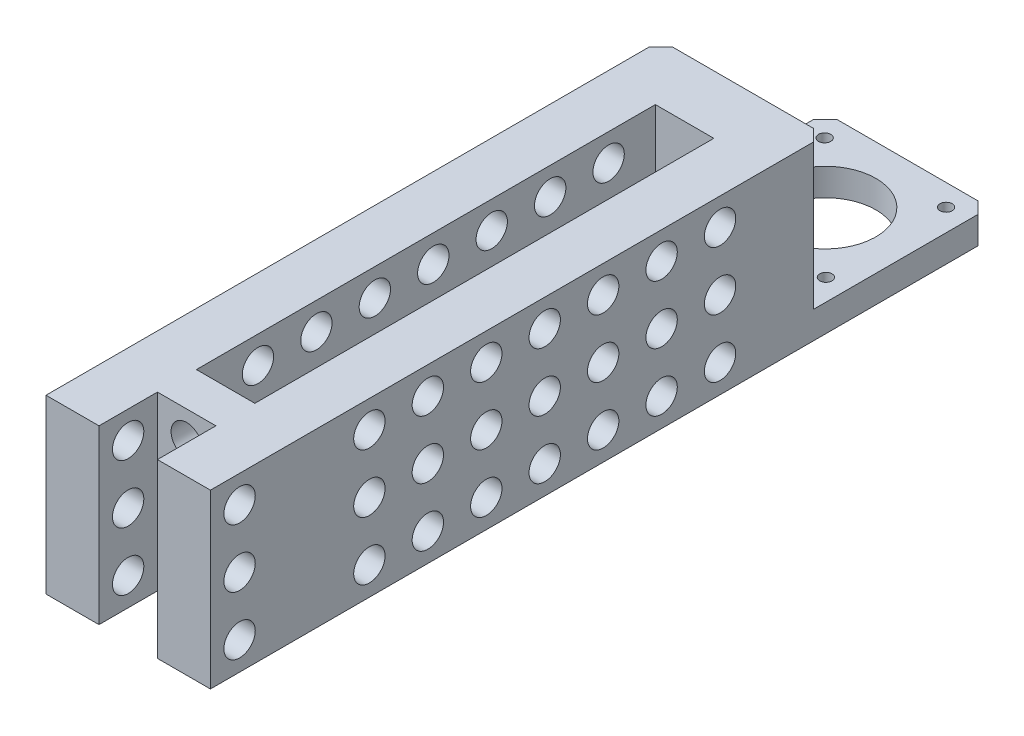
from build123d import *

# Parameters (mm, degrees)
SKETCH1_W           = 15
SKETCH1_H           = 117.8
BOSS_EXTRUDE1_DEPTH = 44.2
SKETCH2_W           = 42.2
SKETCH2_H           = 42.2
CUT_EXTRUDE1_DEPTH  = 37.2
SKETCH3_R           = 13
SKETCH3_R_2         = 1.575
SKETCH3_R_3         = 4.1
CUT_EXTRUDE2_DEPTH  = 30
SKETCH5_R           = 4.025
CUT_EXTRUDE3_DEPTH  = 55
SKETCH6_R           = 4
CUT_EXTRUDE4_DEPTH  = 10
CHAMFER1_SIZE       = 3


with BuildPart() as part:
    # Sketch1 → Boss-Extrude1 (new body)
    with BuildSketch(Plane(origin=(0, 0, 0), x_dir=(1, 0, 0), z_dir=(0, 1, 0))):
        Polygon((0, 0), (-42.2, 0), (-42.2, -200), (-28.6, -200), (-28.6, -185), (-13.6, -185), (-13.6, -200), (0, -200), align=None)
        with Locations((-21.1, -116.1)):
            Rectangle(SKETCH1_W, SKETCH1_H, mode=Mode.SUBTRACT)
    extrude(amount=BOSS_EXTRUDE1_DEPTH)

    # Sketch2 → Cut-Extrude1 (cut)
    with BuildSketch(Plane(origin=(0, 44.2, 0), x_dir=(1, 0, 0), z_dir=(0, 1, 0))):
        with Locations((-21.1, -21.1)):
            Rectangle(SKETCH2_W, SKETCH2_H)
    extrude(amount=-CUT_EXTRUDE1_DEPTH, mode=Mode.SUBTRACT)

    # Sketch3 → Cut-Extrude2 (cut)
    with BuildSketch(Plane.XZ):
        with Locations(Location((-21.1, 21.1, 0), (0, 0, 270))):
            Circle(SKETCH3_R)
        with Locations(Location((-36.519316662, 36.680683338, 0), (0, 0, 270))):
            Circle(SKETCH3_R_2)
        with Locations(Location((-5.519316662, 36.519316662, 0), (0, 0, 270))):
            Circle(SKETCH3_R_2)
        with Locations(Location((-5.680683338, 5.519316662, 0), (0, 0, 270))):
            Circle(SKETCH3_R_2)
        with Locations(Location((-36.680683338, 5.680683338, 0), (0, 0, 270))):
            Circle(SKETCH3_R_2)
        with Locations(Location((-21.1, 50, 0), (0, 0, 270))):
            Circle(SKETCH3_R_3)
        with Locations(Location((-5.6, 50, 0), (0, 0, 270))):
            Circle(SKETCH3_R_3)
        with Locations(Location((-36.6, 50, 0), (0, 0, 270))):
            Circle(SKETCH3_R_3)
    extrude(amount=-CUT_EXTRUDE2_DEPTH, mode=Mode.SUBTRACT)

    # Sketch5 → Cut-Extrude3 (cut)
    with BuildSketch(Plane(origin=(0, 0, 0), x_dir=(0, 0, -1), z_dir=(1, 0, 0))):
        with Locations((-69.2, 37.2)):
            Circle(SKETCH5_R)
        with Locations((-84.2, 37.2)):
            Circle(SKETCH5_R)
        with Locations((-99.2, 37.2)):
            Circle(SKETCH5_R)
        with Locations((-114.2, 37.2)):
            Circle(SKETCH5_R)
        with Locations((-84.2, 22.2)):
            Circle(SKETCH5_R)
        with Locations((-99.2, 22.2)):
            Circle(SKETCH5_R)
        with Locations((-114.2, 22.2)):
            Circle(SKETCH5_R)
        with Locations((-84.2, 7.2)):
            Circle(SKETCH5_R)
        with Locations((-99.2, 7.2)):
            Circle(SKETCH5_R)
        with Locations((-114.2, 7.2)):
            Circle(SKETCH5_R)
        with Locations((-69.2, 22.2)):
            Circle(SKETCH5_R)
        with Locations((-69.2, 7.2)):
            Circle(SKETCH5_R)
        with Locations((-192.52, 37.2)):
            Circle(SKETCH5_R)
        with Locations((-192.52, 22.2)):
            Circle(SKETCH5_R)
        with Locations((-192.52, 7.2)):
            Circle(SKETCH5_R)
        with Locations((-129.2, 37.2)):
            Circle(SKETCH5_R)
        with Locations((-144.2, 37.2)):
            Circle(SKETCH5_R)
        with Locations((-159.2, 37.2)):
            Circle(SKETCH5_R)
        with Locations((-129.2, 22.2)):
            Circle(SKETCH5_R)
        with Locations((-144.2, 22.2)):
            Circle(SKETCH5_R)
        with Locations((-159.2, 22.2)):
            Circle(SKETCH5_R)
        with Locations((-129.2, 7.2)):
            Circle(SKETCH5_R)
        with Locations((-144.2, 7.2)):
            Circle(SKETCH5_R)
        with Locations((-159.2, 7.2)):
            Circle(SKETCH5_R)
    extrude(amount=-CUT_EXTRUDE3_DEPTH, mode=Mode.SUBTRACT)

    # Sketch6 → Cut-Extrude4 (cut)
    with BuildSketch(Plane.XY.offset(185)):
        with Locations((-21.1, 37.2)):
            Circle(SKETCH6_R)
        with Locations((-21.1, 22.2)):
            Circle(SKETCH6_R)
        with Locations((-21.1, 7.2)):
            Circle(SKETCH6_R)
    extrude(amount=-CUT_EXTRUDE4_DEPTH, mode=Mode.SUBTRACT)

    # Chamfer1
    chamfer1_edges = [part.edges().sort_by_distance(p)[0] for p in [
        (-42.2, 3.5, 0),
        (0, 3.5, 0),
        (-42.2, 25.6, 42.2),
        (0, 25.6, 42.2),
    ]]
    chamfer(chamfer1_edges, length=CHAMFER1_SIZE)


solid = part.part
